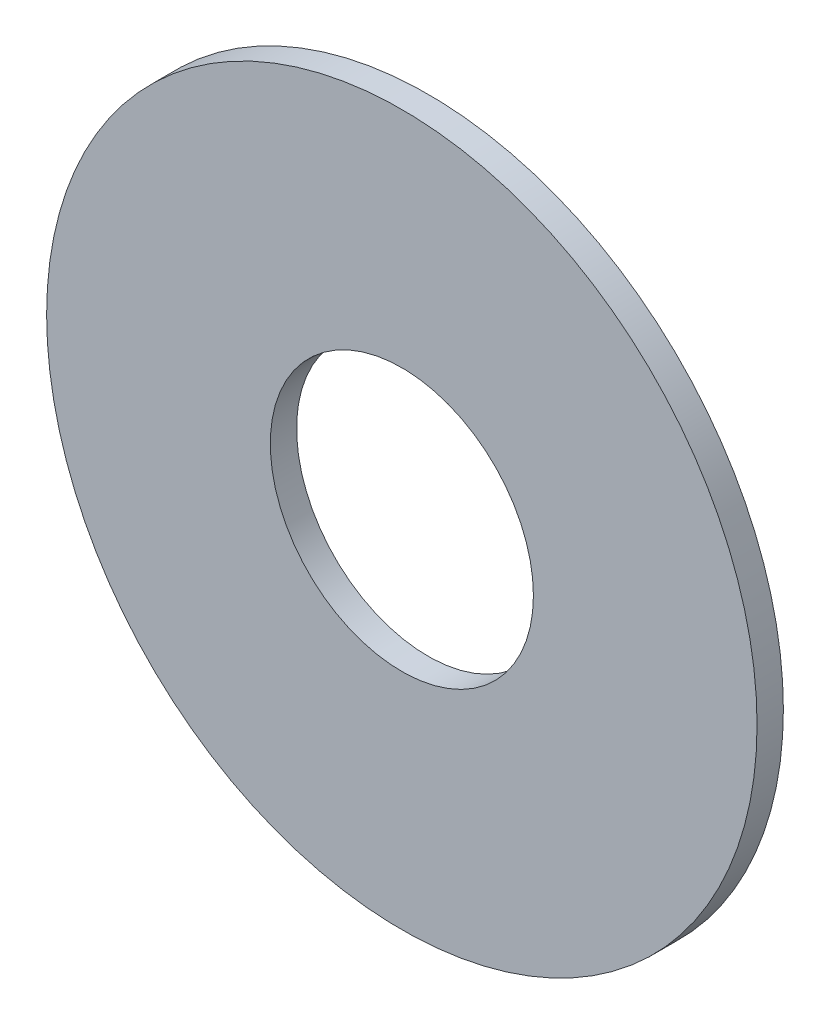
from build123d import *

# Parameters (mm, degrees)
SKETCH_1_R      = 27
SKETCH_1_R_2    = 10
EXTRUDE_1_DEPTH = 2


with BuildPart() as part:
    # 草图1 → 凸台-拉伸1 (new body)
    with BuildSketch(Plane.XY):
        Circle(SKETCH_1_R)
        Circle(SKETCH_1_R_2, mode=Mode.SUBTRACT)
    extrude(amount=EXTRUDE_1_DEPTH)


solid = part.part
